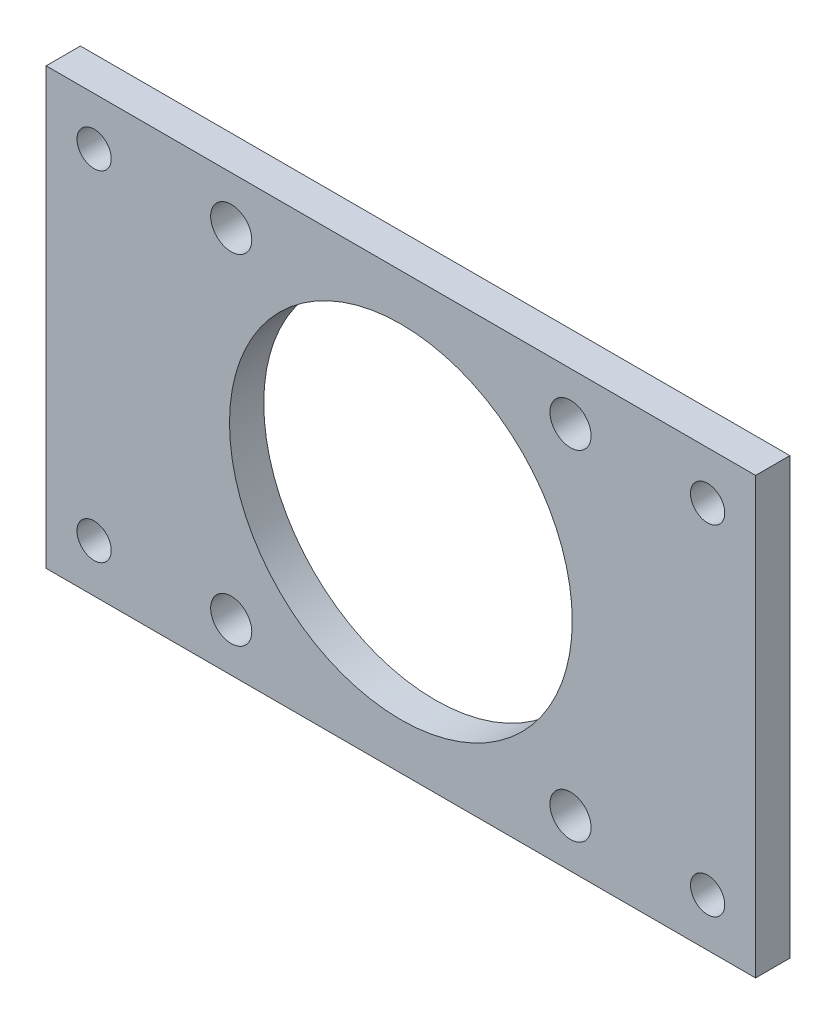
from build123d import *

# Parameters (mm, degrees)
SKETCH1_W           = 103.497474684
SKETCH1_H           = 63.497474684
SKETCH1_R           = 25
SKETCH1_R_2         = 3
SKETCH1_R_3         = 2.5
BOSS_EXTRUDE1_DEPTH = 5


with BuildPart() as part:
    # Sketch1 → Boss-Extrude1 (new body)
    with BuildSketch(Plane.XY):
        Rectangle(SKETCH1_W, SKETCH1_H)
        Circle(SKETCH1_R, mode=Mode.SUBTRACT)
        with Locations((24.748737342, 24.748737342)):
            Circle(SKETCH1_R_2, mode=Mode.SUBTRACT)
        with Locations((24.748737342, -24.748737342)):
            Circle(SKETCH1_R_2, mode=Mode.SUBTRACT)
        with Locations((-24.748737342, -24.748737342)):
            Circle(SKETCH1_R_2, mode=Mode.SUBTRACT)
        with Locations((-24.748737342, 24.748737342)):
            Circle(SKETCH1_R_2, mode=Mode.SUBTRACT)
        with Locations((44.748737342, 24.748737342)):
            Circle(SKETCH1_R_3, mode=Mode.SUBTRACT)
        with Locations(Location((44.748737342, -24.748737342, 0), (0, 0, 180))):
            Circle(SKETCH1_R_3, mode=Mode.SUBTRACT)
        with Locations((-44.748737342, -24.748737342)):
            Circle(SKETCH1_R_3, mode=Mode.SUBTRACT)
        with Locations(Location((-44.748737342, 24.748737342, 0), (0, 0, 180))):
            Circle(SKETCH1_R_3, mode=Mode.SUBTRACT)
    extrude(amount=BOSS_EXTRUDE1_DEPTH)


solid = part.part
